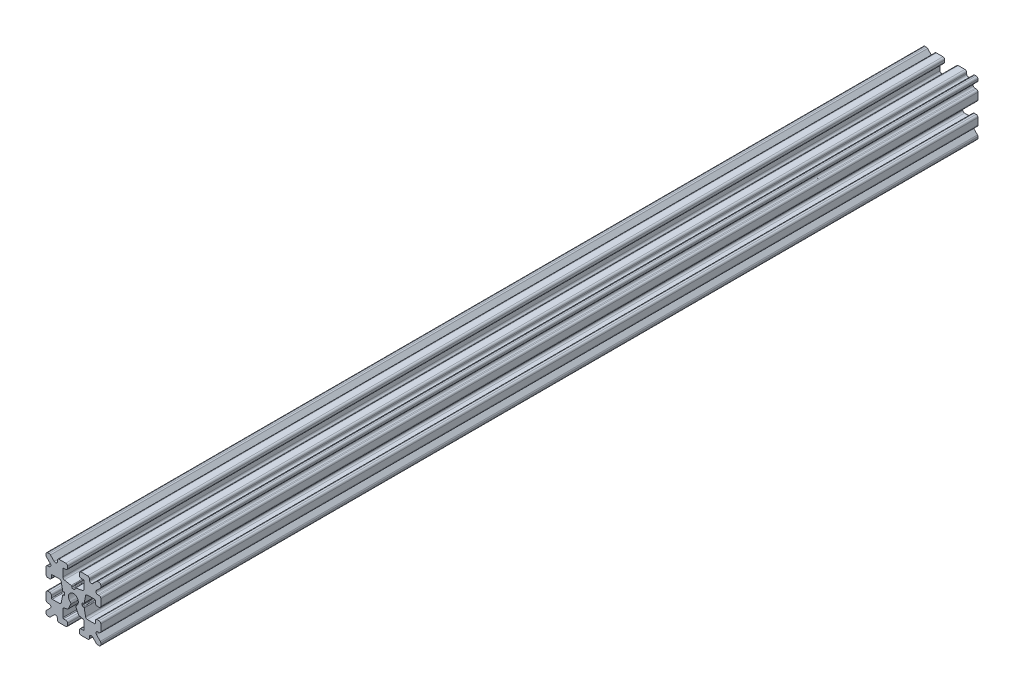
from build123d import *

# Parameters (mm, degrees)
SKETCH1_W           = 15
SKETCH1_H           = 15
SKETCH1_R           = 1.35
BOSS_EXTRUDE1_DEPTH = 120
FILLET1_R           = 0.5
CUT_EXTRUDE1_DEPTH  = 241.234260671
CUT_EXTRUDE3_DEPTH  = 241.234260671
FILLET3_R           = 0.5
FILLET4_R           = 0.5
FILLET5_R           = 3
FILLET6_R           = 0.2
CUT_EXTRUDE4_DEPTH  = 241.234260671
FILLET8_R           = 0.5
SKETCH6_W           = 6.249171159
SKETCH6_H           = 0.889
SKETCH6_W_2         = 0.889
SKETCH6_H_2         = 6.249171159
CUT_EXTRUDE5_DEPTH  = 241.234260671
CUT_EXTRUDE6_DEPTH  = 241.234260671
FILLET9_R           = 0.5
FILLET10_R          = 0.2


with BuildPart() as part:
    # Sketch1 → Boss-Extrude1 (new, symmetric)
    with BuildSketch(Plane.XY):
        Rectangle(SKETCH1_W, SKETCH1_H)
        Circle(SKETCH1_R, mode=Mode.SUBTRACT)
    extrude(amount=BOSS_EXTRUDE1_DEPTH, both=True)

    # Fillet1
    fillet1_edges = [part.edges().sort_by_distance(p)[0] for p in [
        (7.5, -7.5, 0),
        (-7.5, -7.5, 0),
        (-7.5, 7.5, 0),
        (7.5, 7.5, 0),
    ]]
    fillet(fillet1_edges, radius=FILLET1_R)

    # Sketch2 → Cut-Extrude1 (cut, through all)
    with BuildSketch(Plane.XY.offset(120)):
        Polygon((-7.5, 1.6), (-6, 1.6), (-6, 2.9), (-3.4, 2.9), (-3.4, -2.9), (-6, -2.9), (-6, -1.6), (-7.5, -1.6), align=None)
        Polygon((2.9, 6), (1.6, 6), (1.6, 7.5), (-1.6, 7.5), (-1.6, 6), (-2.9, 6), (-2.9, 3.4), (2.9, 3.4), align=None)
        Polygon((-1.6, -7.5), (-1.6, -6), (-2.9, -6), (-2.9, -3.4), (2.9, -3.4), (2.9, -6), (1.6, -6), (1.6, -7.5), align=None)
        Polygon((6, -2.9), (6, -1.6), (7.5, -1.6), (7.5, 1.6), (6, 1.6), (6, 2.9), (3.4, 2.9), (3.4, -2.9), align=None)
    extrude(amount=-CUT_EXTRUDE1_DEPTH, mode=Mode.SUBTRACT)

    # Sketch4 → Cut-Extrude3 (cut, through all)
    with BuildSketch(Plane.XY.offset(120)):
        Polygon((-3.4, 2.9), (-2.85, 0), (-3.4, -2.9), align=None)
        Polygon((-2.9, 3.4), (0, 2.85), (2.9, 3.4), align=None)
        Polygon((3.4, 2.9), (2.85, 0), (3.4, -2.9), align=None)
        Polygon((-2.9, -3.4), (0, -2.85), (2.9, -3.4), align=None)
    extrude(amount=-CUT_EXTRUDE3_DEPTH, mode=Mode.SUBTRACT)

    # Fillet3
    fillet3_edges = [part.edges().sort_by_distance(p)[0] for p in [
        (1.6, -7.5, 0),
        (-1.6, -7.5, 0),
        (-1.6, -6, 0),
        (1.6, -6, 0),
        (6, 1.6, 0),
        (7.5, 1.6, 0),
        (7.5, -1.6, 0),
        (6, -1.6, 0),
        (-7.5, -1.6, 0),
        (-7.5, 1.6, 0),
        (-6, 1.6, 0),
        (-6, -1.6, 0),
        (-1.6, 6, 0),
        (-1.6, 7.5, 0),
        (1.6, 7.5, 0),
        (1.6, 6, 0),
    ]]
    fillet(fillet3_edges, radius=FILLET3_R)

    # Fillet4
    fillet4_edges = [part.edges().sort_by_distance(p)[0] for p in [
        (-2.9, -3.4, 0),
        (2.9, -3.4, 0),
        (3.4, -2.9, 0),
        (3.4, 2.9, 0),
        (-3.4, 2.9, 0),
        (-3.4, -2.9, 0),
        (2.9, 3.4, 0),
        (-2.9, 3.4, 0),
    ]]
    fillet(fillet4_edges, radius=FILLET4_R)

    # Fillet5
    fillet5_edges = [part.edges().sort_by_distance(p)[0] for p in [
        (-2.85, 0, 0),
        (0, 2.85, 0),
        (2.85, 0, 0),
        (0, -2.85, 0),
    ]]
    fillet(fillet5_edges, radius=FILLET5_R)

    # Fillet6
    fillet6_edges = [part.edges().sort_by_distance(p)[0] for p in [
        (-2.9, -6, 0),
        (2.9, -6, 0),
        (6, -2.9, 0),
        (6, 2.9, 0),
        (-6, 2.9, 0),
        (-6, -2.9, 0),
        (2.9, 6, 0),
        (-2.9, 6, 0),
    ]]
    fillet(fillet6_edges, radius=FILLET6_R)

    # Sketch5 → Cut-Extrude4 (cut, through all)
    with BuildSketch(Plane.XY.offset(120)):
        Polygon((-7.5, 6.439339828), (-5.460660172, 4.4), (-7.5, 4.4), align=None)
        Polygon((-6.439339828, 7.5), (-4.4, 5.460660172), (-4.4, 7.5), align=None)
        Polygon((4.4, 7.5), (6.439339828, 7.5), (4.4, 5.460660172), align=None)
        Polygon((7.5, 6.439339828), (7.5, 4.4), (5.460660172, 4.4), align=None)
        Polygon((7.5, -6.439339828), (5.460660172, -4.4), (7.5, -4.4), align=None)
        Polygon((6.439339828, -7.5), (4.4, -5.460660172), (4.4, -7.5), align=None)
        Polygon((-4.4, -7.5), (-6.439339828, -7.5), (-4.4, -5.460660172), align=None)
        Polygon((-7.5, -6.439339828), (-7.5, -4.4), (-5.460660172, -4.4), align=None)
    extrude(amount=-CUT_EXTRUDE4_DEPTH, mode=Mode.SUBTRACT)

    # Fillet8
    fillet8_edges = [part.edges().sort_by_distance(p)[0] for p in [
        (-7.5, 4.4, 0),
        (-7.5, 6.439339828, 0),
        (-5.460660172, 4.4, 0),
        (7.5, -4.4, 0),
        (7.5, -6.439339828, 0),
        (5.460660172, -4.4, 0),
        (5.460660172, 4.4, 0),
        (7.5, 6.439339828, 0),
        (7.5, 4.4, 0),
        (-4.4, 7.5, 0),
        (-4.4, 5.460660172, 0),
        (-6.439339828, 7.5, 0),
        (-5.460660172, -4.4, 0),
        (-7.5, -6.439339828, 0),
        (-7.5, -4.4, 0),
        (4.4, 5.460660172, 0),
        (4.4, 7.5, 0),
        (6.439339828, 7.5, 0),
        (6.439339828, -7.5, 0),
        (4.4, -7.5, 0),
        (4.4, -5.460660172, 0),
        (-6.439339828, -7.5, 0),
        (-4.4, -5.460660172, 0),
        (-4.4, -7.5, 0),
    ]]
    fillet(fillet8_edges, radius=FILLET8_R)

    # Sketch6 → Cut-Extrude5 (cut, through all)
    with BuildSketch(Plane.XY.offset(120)):
        with Locations((5.530603002, 0)):
            Rectangle(SKETCH6_W, SKETCH6_H)
        with Locations((-5.530603002, 0)):
            Rectangle(SKETCH6_W, SKETCH6_H)
        with Locations((0, 5.530603002)):
            Rectangle(SKETCH6_W_2, SKETCH6_H_2)
    extrude(amount=-CUT_EXTRUDE5_DEPTH, mode=Mode.SUBTRACT)

    # Sketch7 → Cut-Extrude6 (cut, through all)
    with BuildSketch(Plane.XY.offset(120)):
        Polygon((0, 0), (-2.153335353, -4.617842566), (2.153335353, -4.617842566), align=None)
    extrude(amount=-CUT_EXTRUDE6_DEPTH, mode=Mode.SUBTRACT)

    # Fillet9
    fillet9_edges = [part.edges().sort_by_distance(p)[0] for p in [
        (1.457911068, -3.126500375, 0),
        (-1.457911068, -3.126500375, 0),
        (-0.570534653, -1.223515512, 0),
        (0.570534653, -1.223515512, 0),
    ]]
    fillet(fillet9_edges, radius=FILLET9_R)

    # Fillet10
    fillet10_edges = [part.edges().sort_by_distance(p)[0] for p in [
        (-2.406017422, 0.4445, 0),
        (-2.406017422, -0.4445, 0),
        (0.4445, 2.406017422, 0),
        (-0.4445, 2.406017422, 0),
        (2.406017422, 0.4445, 0),
        (2.406017422, -0.4445, 0),
        (-2.93658978, -0.4445, 0),
        (-2.93658978, 0.4445, 0),
        (2.93658978, -0.4445, 0),
        (2.93658978, 0.4445, 0),
        (0.4445, 2.93658978, 0),
        (-0.4445, 2.93658978, 0),
    ]]
    fillet(fillet10_edges, radius=FILLET10_R)


solid = part.part
